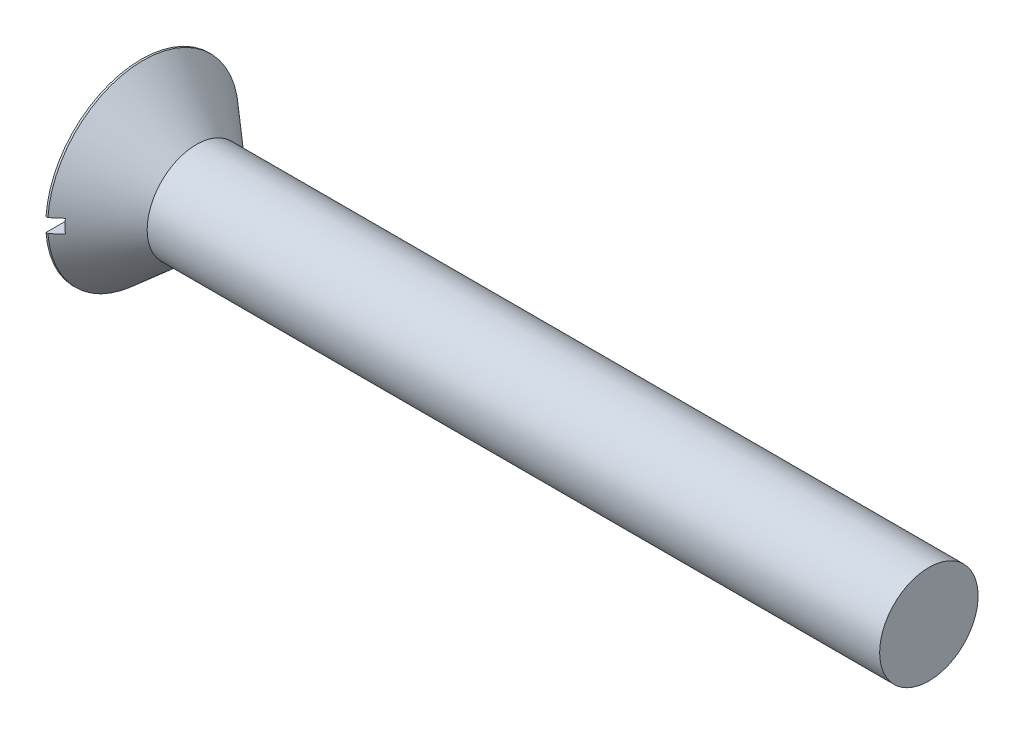
from build123d import *

# Parameters (mm, degrees)
SKETCH6_W  = 24.638
SKETCH6_H  = 1.778
SLOT_DEPTH = 1.4478


with BuildPart() as part:
    # BodySke → Base-Revolve (revolve)
    with BuildSketch(Plane.XY, mode=Mode.PRIVATE) as base_revolve_sk:
        Polygon((0, 0), (0, 12.319), (0.245450977, 12.319), (7.112, 6.35), (101.6, 6.35), (101.6, 0), align=None)
    revolve(base_revolve_sk.sketch.rotate(Axis((-6.35, 0, 0), (1, 0, 0)), 90), axis=Axis((-6.35, 0, 0), (1, 0, 0)))

    # Sketch6 → Slot (cut)
    with BuildSketch(Plane.ZY):
        Rectangle(SKETCH6_W, SKETCH6_H)
    extrude(amount=-SLOT_DEPTH, mode=Mode.SUBTRACT)


solid = part.part
